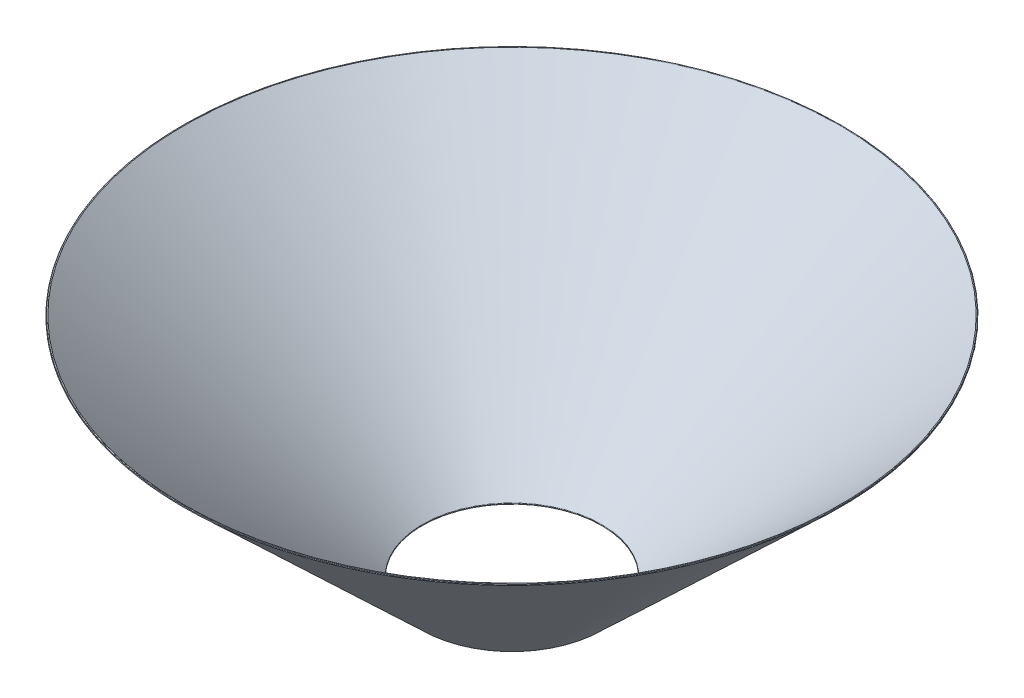
from build123d import *


with BuildPart() as part:
    # Эскиз2 → Повернуть1 (revolve)
    with BuildSketch(Plane.XY, mode=Mode.PRIVATE) as revolve_1_sk:
        with BuildLine():
            Line((99.47989222, 92.177858052), (27.175004903, 23.67849112))
            ThreePointArc((27.175004903, 23.67849112), (27.112626839, 23.538704015), (27.167363296, 23.395751653))
            Line((27.167363296, 23.395751653), (27.236137761, 23.323156385))
            ThreePointArc((27.236137761, 23.323156385), (27.375924866, 23.260778321), (27.518877227, 23.315514778))
            Line((27.518877227, 23.315514778), (99.823764544, 91.81488171))
            ThreePointArc((99.823764544, 91.81488171), (99.886142609, 91.954668814), (99.831406152, 92.097621176))
            Line((99.831406152, 92.097621176), (99.762631687, 92.170216445))
            ThreePointArc((99.762631687, 92.170216445), (99.622844582, 92.232594509), (99.47989222, 92.177858052))
        make_face()
    revolve(revolve_1_sk.sketch.rotate(Axis((0, -32.617744242, 0), (0, 1, 0)), 90), axis=Axis((0, -32.617744242, 0), (0, 1, 0)))


solid = part.part
